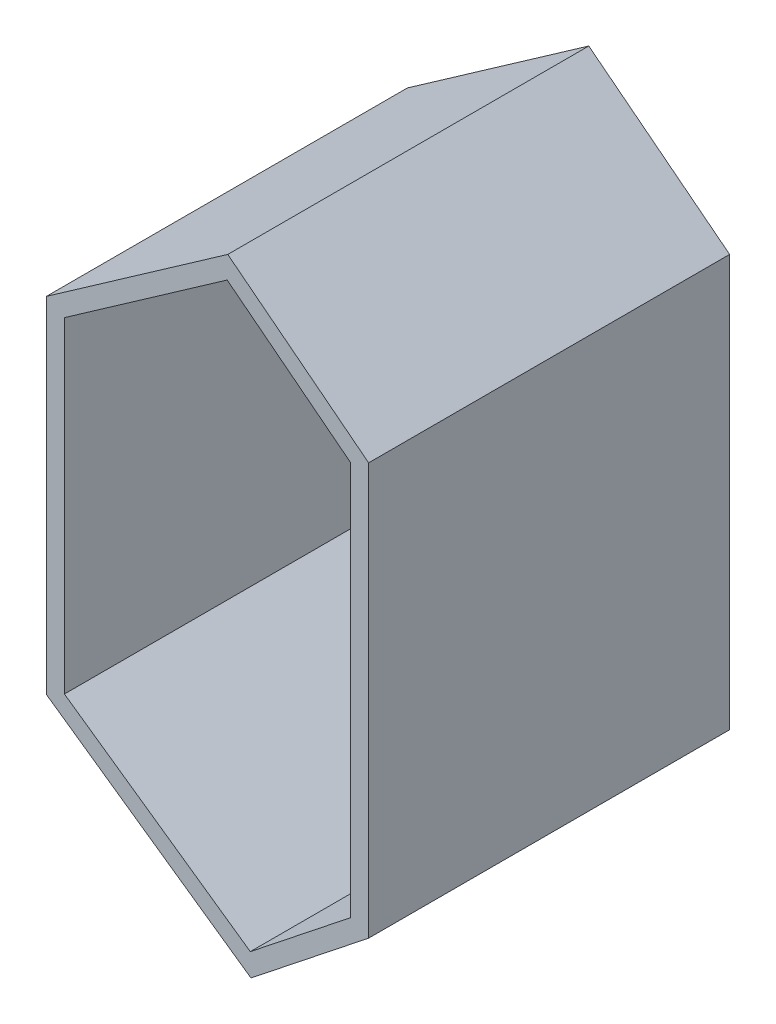
from build123d import *

# Parameters (mm, degrees)
BOSS_EXTRUDE1_DEPTH = 12


with BuildPart() as part:
    # Sketch1 → Boss-Extrude1 (new body)
    with BuildSketch(Plane.XY):
        Polygon((23.002215311, -29.371596289), (18.32005302, -25.71349019), (17.806104696, -26.07336068), (12.290321363, -29.935553749), (12.290321363, -41.394710348), (19.091253879, -46.156774563), (23.002215311, -43.055211302), align=None)
        Polygon((18.150250558, -26.564851907), (12.890321363, -30.24789398), (12.890321363, -41.082370118), (19.06894702, -45.408690378), (22.402215311, -42.765263014), (22.402215311, -29.664235842), (18.300514505, -26.459635958), align=None, mode=Mode.SUBTRACT)
    extrude(amount=BOSS_EXTRUDE1_DEPTH)


solid = part.part
